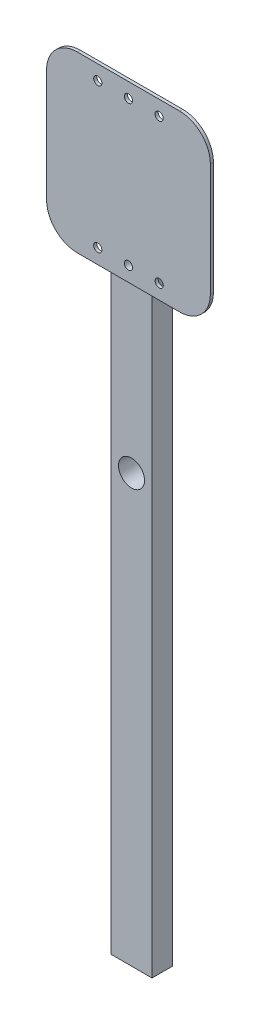
from build123d import *

# Parameters (mm, degrees)
CROQUIS1_R                 = 4
SALIENTE_EXTRUIR1_DEPTH    = 3
CROQUIS2_W                 = 40
CROQUIS2_H                 = 665
CROQUIS2_R                 = 12.7
SALIENTE_EXTRUIR2_DEPTH    = 20
CORTAR_EXTRUIR1_DEPTH      = 99
CORTAR_EXTRUIR1_DEPTH_BACK = 71
CROQUIS3_R                 = 4


with BuildPart() as part:
    # Croquis1 → Saliente-Extruir1 (new body)
    with BuildSketch(Plane.XY):
        with BuildLine():
            Line((-50, 85), (50, 85))
            ThreePointArc((50, 85), (71.213203436, 76.213203436), (80, 55))
            Line((80, 55), (80, -55))
            ThreePointArc((80, -55), (71.213203436, -76.213203436), (50, -85))
            Line((50, -85), (-50, -85))
            ThreePointArc((-50, -85), (-71.213203436, -76.213203436), (-80, -55))
            Line((-80, -55), (-80, 55))
            ThreePointArc((-80, 55), (-71.213203436, 76.213203436), (-50, 85))
        make_face()
        with Locations((0, 70.6)):
            Circle(CROQUIS1_R, mode=Mode.SUBTRACT)
        with Locations((0, -70.6)):
            Circle(CROQUIS1_R, mode=Mode.SUBTRACT)
        with Locations((-30, 70.6)):
            Circle(CROQUIS1_R, mode=Mode.SUBTRACT)
        with Locations((30, 70.6)):
            Circle(CROQUIS1_R, mode=Mode.SUBTRACT)
        with Locations((-30, -70.6)):
            Circle(CROQUIS1_R, mode=Mode.SUBTRACT)
        with Locations((30, -70.6)):
            Circle(CROQUIS1_R, mode=Mode.SUBTRACT)
    extrude(amount=SALIENTE_EXTRUIR1_DEPTH)

    # Croquis2 → Saliente-Extruir2 (add)
    with BuildSketch(Plane.XY):
        with Locations((0, -332.5)):
            Rectangle(CROQUIS2_W, CROQUIS2_H)
        with Locations((0, -247.75)):
            Circle(CROQUIS2_R, mode=Mode.SUBTRACT)
    extrude(amount=-SALIENTE_EXTRUIR2_DEPTH)

    # Croquis3 → Cortar-Extruir1 (cut, two sides: drawn at the far end of the back side and taken through both)
    with BuildSketch(Plane.XY.offset(-CORTAR_EXTRUIR1_DEPTH_BACK)):
        with Locations((0, -70.6)):
            Circle(CROQUIS3_R)
    extrude(amount=CORTAR_EXTRUIR1_DEPTH + CORTAR_EXTRUIR1_DEPTH_BACK, mode=Mode.SUBTRACT)


solid = part.part
